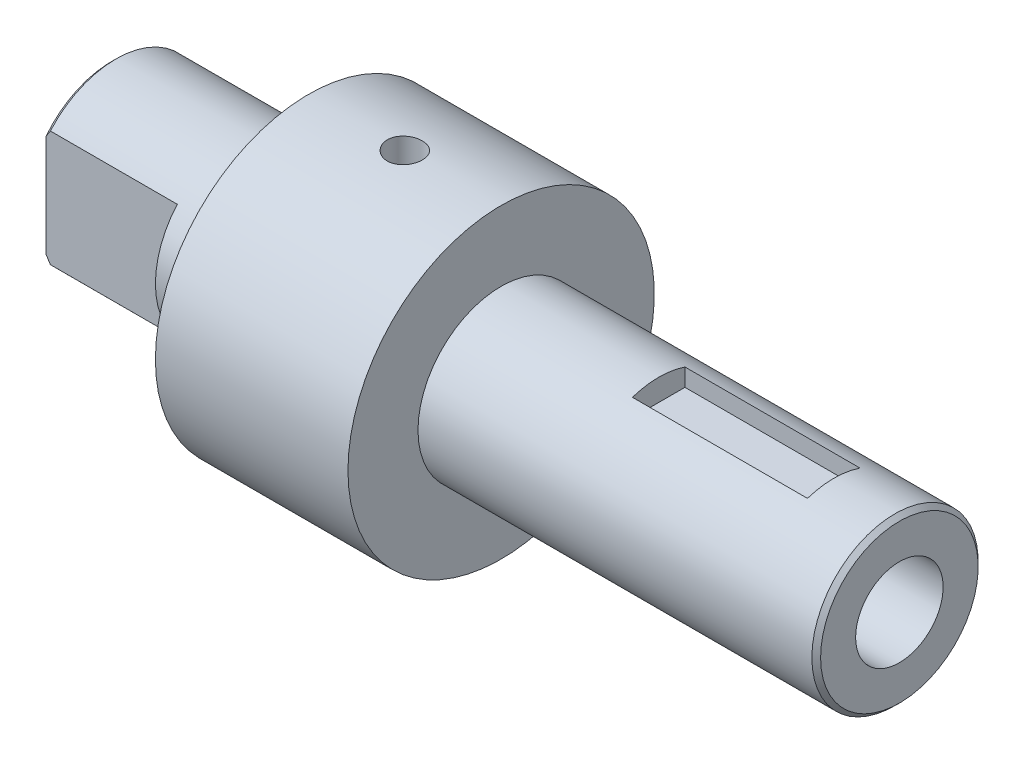
from build123d import *

# Parameters (mm, degrees)
CUT_EXTRUDE_START        = -30
CUT_EXTRUDE_5_DEPTH      = 30
CUT_EXTRUDE_6_DEPTH      = 187.681547026
CUT_EXTRUDE_6_DEPTH_BACK = 187.681547026
SKETCH_9_R               = 4
SKETCH_6_W               = 40
SKETCH_6_H               = 5
CUT_EXTRUDE_4_DEPTH      = 6
CHAMFER_3_SIZE           = 1


with BuildPart() as part:
    # Эскиз1 → Повернуть1 (revolve)
    with BuildSketch(Plane.XY, mode=Mode.PRIVATE) as revolve_1_sk:
        Polygon((0, 10), (0, 20), (45, 20), (45, 35), (89, 35), (89, 19), (180, 19), (180, 10), align=None)
    revolve(revolve_1_sk.sketch.rotate(Axis((0, 0, 0), (1, 0, 0)), 90), axis=Axis((0, 0, 0), (1, 0, 0)))

    # Эскиз8 → Вырез-Вытянуть5 (cut)
    with BuildSketch(Plane.ZY.offset(CUT_EXTRUDE_START)):
        with BuildLine():
            Line((15, 13.228756555), (15, -13.228756555))
            ThreePointArc((15, -13.228756555), (20, 0), (15, 13.228756555))
        make_face()
        with BuildLine():
            Line((-15, 13.228756555), (-15, -13.228756555))
            ThreePointArc((-15, -13.228756555), (-20, 0), (-15, 13.228756555))
        make_face()
    extrude(amount=CUT_EXTRUDE_5_DEPTH, mode=Mode.SUBTRACT)

    # Эскиз9 → Вырез-Вытянуть6 (cut, two sides: drawn at the far end of the back side and taken through both)
    with BuildSketch(Plane(origin=(0, 0, 0), x_dir=(1, 0, 0), z_dir=(0, 1, 0)).offset(-CUT_EXTRUDE_6_DEPTH_BACK)):
        with Locations(Location((67, 0, 0), (0, 0, 270))):
            Circle(SKETCH_9_R)
    extrude(amount=CUT_EXTRUDE_6_DEPTH + CUT_EXTRUDE_6_DEPTH_BACK, mode=Mode.SUBTRACT)

    # Эскиз6 → Вырез-Вытянуть4 (cut, symmetric)
    with BuildSketch(Plane.XY):
        with Locations((145, 16.5)):
            Rectangle(SKETCH_6_W, SKETCH_6_H)
    extrude(amount=CUT_EXTRUDE_4_DEPTH, both=True, mode=Mode.SUBTRACT)

    # Фаска3
    chamfer_3_edges = [part.edges().sort_by_distance(p)[0] for p in [
        (0, -20, 0),
        (180, 0, -19),
        (0, 20, 0),
    ]]
    chamfer(chamfer_3_edges, length=CHAMFER_3_SIZE)


solid = part.part
